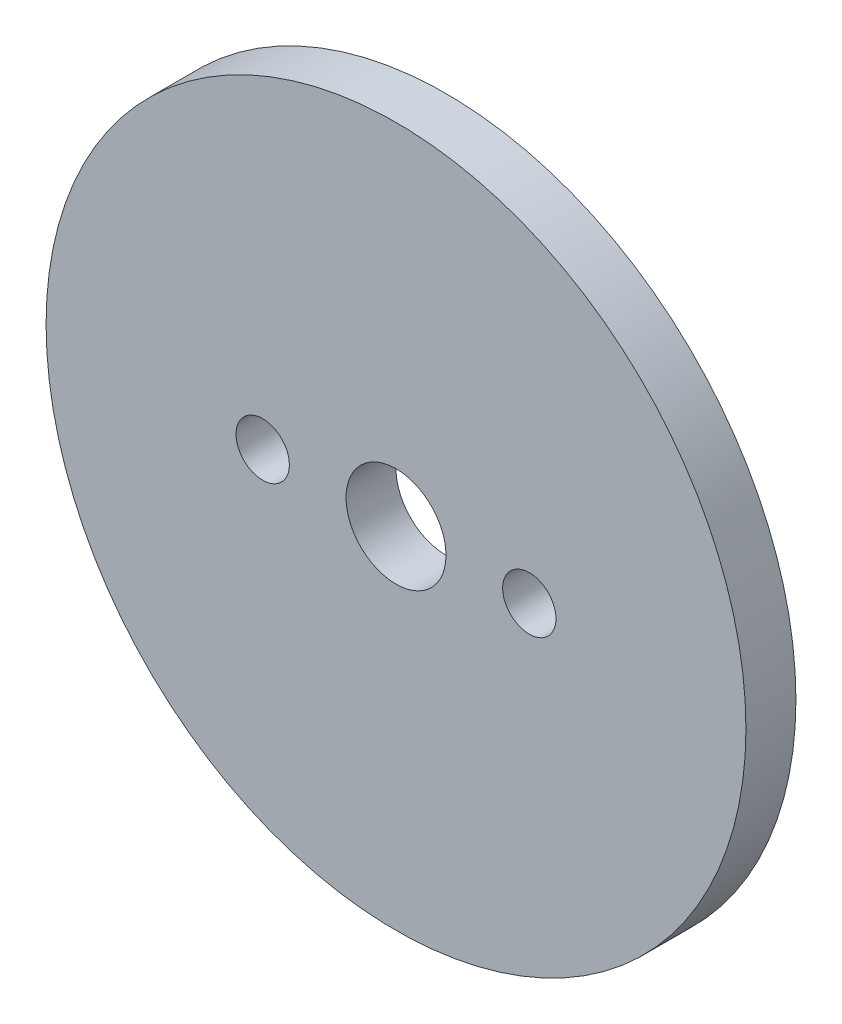
from build123d import *

# Parameters (mm, degrees)
ESBO_O1_R                = 21
ESBO_O1_R_2              = 3
ESBO_O1_R_3              = 1.6
RESSALTO_EXTRUS_O1_DEPTH = 1.5


with BuildPart() as part:
    # Esboço1 → Ressalto-extrusão1 (new, symmetric)
    with BuildSketch(Plane.XY):
        Circle(ESBO_O1_R)
        Circle(ESBO_O1_R_2, mode=Mode.SUBTRACT)
        with Locations((-8, 0)):
            Circle(ESBO_O1_R_3, mode=Mode.SUBTRACT)
        with Locations((8, 0)):
            Circle(ESBO_O1_R_3, mode=Mode.SUBTRACT)
    extrude(amount=RESSALTO_EXTRUS_O1_DEPTH, both=True)


solid = part.part
